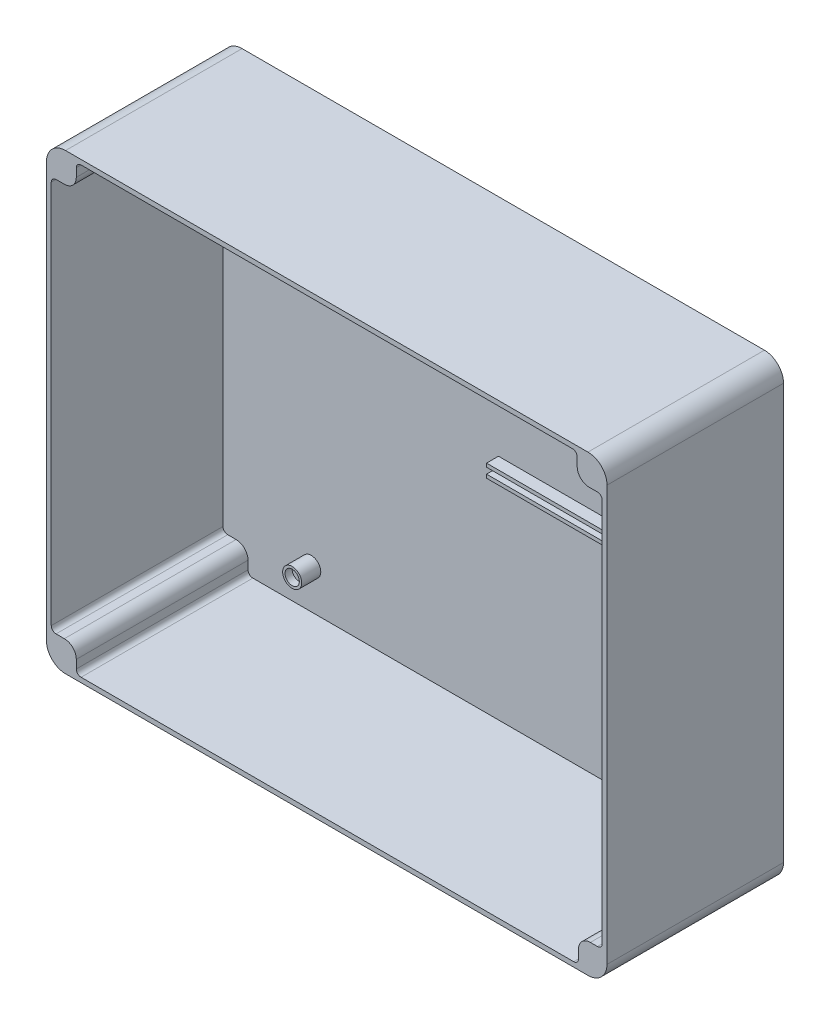
from build123d import *

# Parameters (mm, degrees)
SKETCH1_W           = 235
SKETCH1_H           = 190
BOSS_EXTRUDE1_DEPTH = 74
CUT_EXTRUDE1_DEPTH  = 72
FILLET1_R           = 2
FILLET2_R           = 5
SKETCH3_R           = 4
BOSS_EXTRUDE2_DEPTH = 8
FILLET3_R           = 8
SKETCH4_R           = 3
CUT_EXTRUDE2_DEPTH  = 3
SKETCH5_W           = 1
SKETCH5_H           = 165
BOSS_EXTRUDE3_DEPTH = 5
SKETCH6_W           = 115.5
SKETCH6_H           = 1.5
BOSS_EXTRUDE4_DEPTH = 5
BOSS_EXTRUDE5_DEPTH = 1.5
SKETCH8_W           = 5
SKETCH8_H           = 2.5
CUT_EXTRUDE3_DEPTH  = 5


with BuildPart() as part:
    # Sketch1 → Boss-Extrude1 (new body)
    with BuildSketch(Plane.XY):
        Rectangle(SKETCH1_W, SKETCH1_H)
    extrude(amount=BOSS_EXTRUDE1_DEPTH)

    # Sketch2 → Cut-Extrude1 (cut)
    with BuildSketch(Plane.XY.offset(74)):
        Polygon((105, 93), (-105, 93), (-105, 82.5), (-115.5, 82.5), (-115.5, -82.5), (-105, -82.5), (-105, -93), (105.534797486, -93), (105.534797486, -82.5), (115.5, -82.5), (115.5, 82.5), (105, 82.5), align=None)
    extrude(amount=-CUT_EXTRUDE1_DEPTH, mode=Mode.SUBTRACT)

    # Fillet1
    fillet1_edges = [part.edges().sort_by_distance(p)[0] for p in [
        (-105, -93, 38),
        (-115.5, -82.5, 38),
        (-115.5, 82.5, 38),
        (-105, 93, 38),
        (105, 93, 38),
        (115.5, 82.5, 38),
        (115.5, -82.5, 38),
        (105.534797486, -93, 38),
    ]]
    fillet(fillet1_edges, radius=FILLET1_R)

    # Fillet2
    fillet2_edges = [part.edges().sort_by_distance(p)[0] for p in [
        (-105, -82.5, 38),
        (-105, 82.5, 38),
        (105, 82.5, 38),
        (105.534797486, -82.5, 38),
    ]]
    fillet(fillet2_edges, radius=FILLET2_R)

    # Sketch3 → Boss-Extrude2 (add)
    with BuildSketch(Plane.XY.offset(2)):
        with Locations((-78.5, 76.505)):
            Circle(SKETCH3_R)
        with Locations((78.5, 76.505)):
            Circle(SKETCH3_R)
        with Locations((78.5, -76.505)):
            Circle(SKETCH3_R)
        with Locations((-78.5, -76.505)):
            Circle(SKETCH3_R)
    extrude(amount=BOSS_EXTRUDE2_DEPTH)

    # Fillet3
    fillet3_edges = [part.edges().sort_by_distance(p)[0] for p in [
        (117.5, -95, 37),
        (-117.5, -95, 37),
        (-117.5, 95, 37),
        (117.5, 95, 37),
    ]]
    fillet(fillet3_edges, radius=FILLET3_R)

    # Sketch4 → Cut-Extrude2 (cut)
    with BuildSketch(Plane.XY.offset(10)):
        with Locations((78.5, 76.505)):
            Circle(SKETCH4_R)
        with Locations((78.5, -76.505)):
            Circle(SKETCH4_R)
        with Locations((-78.5, -76.505)):
            Circle(SKETCH4_R)
        with Locations((-78.5, 76.505)):
            Circle(SKETCH4_R)
    extrude(amount=-CUT_EXTRUDE2_DEPTH, mode=Mode.SUBTRACT)

    # Sketch5 → Boss-Extrude3 (add)
    with BuildSketch(Plane.XY.offset(2)):
        with Locations((110, 0)):
            Rectangle(SKETCH5_W, SKETCH5_H)
    extrude(amount=BOSS_EXTRUDE3_DEPTH)

    # Sketch6 → Boss-Extrude4 (add)
    with BuildSketch(Plane.XY.offset(2)):
        with Locations((57.75, 2)):
            Rectangle(SKETCH6_W, SKETCH6_H)
        with Locations((57.75, -2)):
            Rectangle(SKETCH6_W, SKETCH6_H)
    extrude(amount=BOSS_EXTRUDE4_DEPTH)

    # Sketch7 → Boss-Extrude5 (add)
    with BuildSketch(Plane.XZ.offset(2.75)):
        Polygon((107.5, 7), (115.5, 64), (115.5, 7), align=None)
    boss_extrude5 = extrude(amount=-BOSS_EXTRUDE5_DEPTH)

    # Mirror1: Boss-Extrude5 across plane
    add(boss_extrude5.mirror(Plane.ZX))

    # Sketch8 → Cut-Extrude3 (cut)
    with BuildSketch(Plane.ZY.offset(-109.5)):
        with Locations((4.5, 0)):
            Rectangle(SKETCH8_W, SKETCH8_H)
    extrude(amount=-CUT_EXTRUDE3_DEPTH, mode=Mode.SUBTRACT)


solid = part.part
